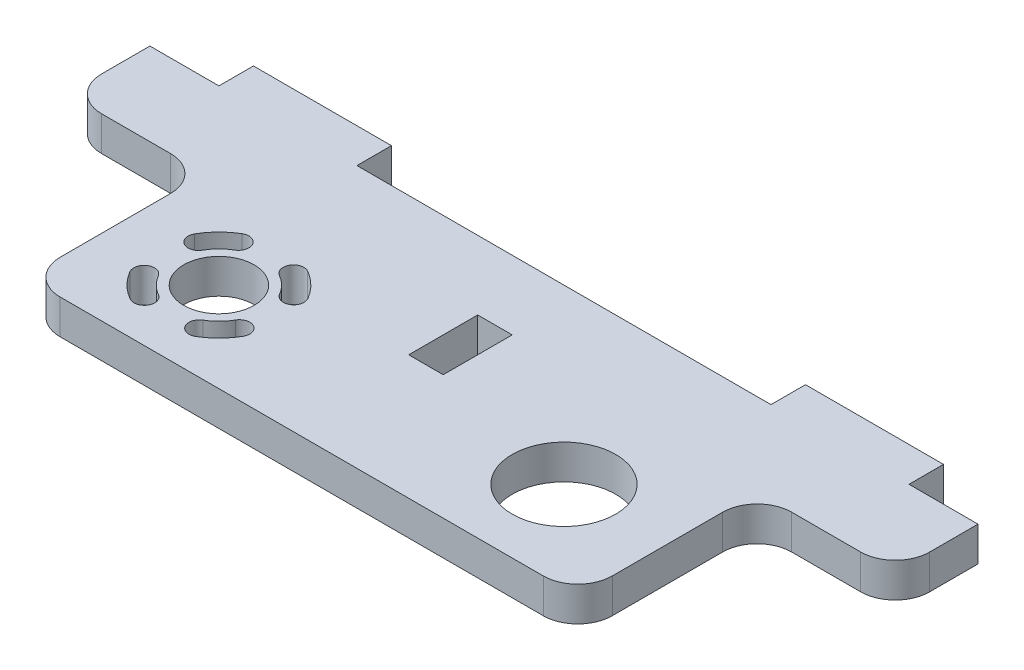
from build123d import *

# Parameters (mm, degrees)
SKETCH_1_R      = 5.1
SKETCH_1_R_2    = 7.5
SKETCH_1_W      = 5
SKETCH_1_H      = 10
EXTRUDE_1_DEPTH = 5


with BuildPart() as part:
    # 草图1 → 凸台-拉伸1 (new body)
    with BuildSketch(Plane(origin=(0, 0, 0), x_dir=(1, 0, 0), z_dir=(0, 1, 0))):
        with BuildLine():
            Line((5, 0), (75, 0))
            ThreePointArc((75, 0), (78.535533906, 1.464466094), (80, 5))
            Line((80, 5), (80, 21))
            ThreePointArc((80, 21), (81.464466094, 24.535533906), (85, 26))
            Line((85, 26), (95, 26))
            ThreePointArc((95, 26), (98.535533906, 27.464466094), (100, 31))
            Line((100, 31), (100, 38))
            Line((100, 38), (90, 38))
            Line((90, 38), (90, 43))
            Line((90, 43), (70, 43))
            Line((70, 43), (70, 38))
            Line((70, 38), (10, 38))
            Line((10, 38), (10, 43))
            Line((10, 43), (-10, 43))
            Line((-10, 43), (-10, 38))
            Line((-10, 38), (-20, 38))
            Line((-20, 38), (-20, 31))
            ThreePointArc((-20, 31), (-18.535533906, 27.464466094), (-15, 26))
            Line((-15, 26), (-5, 26))
            ThreePointArc((-5, 26), (-1.464466094, 24.535533906), (0, 21))
            Line((0, 21), (0, 5))
            ThreePointArc((0, 5), (1.464466094, 1.464466094), (5, 0))
        make_face()
        with Locations(Location((15, 13, 0), (0, 0, 270))):
            Circle(SKETCH_1_R, mode=Mode.SUBTRACT)
        with Locations(Location((65, 13, 0), (0, 0, 270))):
            Circle(SKETCH_1_R_2, mode=Mode.SUBTRACT)
        with Locations((40, 23)):
            Rectangle(SKETCH_1_W, SKETCH_1_H, mode=Mode.SUBTRACT)
        with BuildLine():
            ThreePointArc((10.242718447, 21.134042717), (8.299573716, 19.625606863), (6.813051963, 17.665646852))
            ThreePointArc((6.813051963, 17.665646852), (7.373585621, 15.619723584), (9.419508889, 16.180257242))
            ThreePointArc((9.419508889, 16.180257242), (10.432770655, 17.516229984), (11.757281553, 18.544429117))
            ThreePointArc((11.757281553, 18.544429117), (12.2948068, 20.59651747), (10.242718447, 21.134042717))
        make_face(mode=Mode.SUBTRACT)
        with BuildLine():
            ThreePointArc((23.134042717, 17.757281553), (21.625606863, 19.700426284), (19.665646852, 21.186948037))
            ThreePointArc((19.665646852, 21.186948037), (17.619723584, 20.626414379), (18.180257242, 18.580491111))
            ThreePointArc((18.180257242, 18.580491111), (19.516229984, 17.567229345), (20.544429117, 16.242718447))
            ThreePointArc((20.544429117, 16.242718447), (22.59651747, 15.7051932), (23.134042717, 17.757281553))
        make_face(mode=Mode.SUBTRACT)
        with BuildLine():
            ThreePointArc((19.757281553, 4.865957283), (21.700426284, 6.374393137), (23.186948037, 8.334353148))
            ThreePointArc((23.186948037, 8.334353148), (22.626414379, 10.380276416), (20.580491111, 9.819742758))
            ThreePointArc((20.580491111, 9.819742758), (19.567229345, 8.483770016), (18.242718447, 7.455570883))
            ThreePointArc((18.242718447, 7.455570883), (17.7051932, 5.40348253), (19.757281553, 4.865957283))
        make_face(mode=Mode.SUBTRACT)
        with BuildLine():
            ThreePointArc((6.865957283, 8.242718447), (8.374393137, 6.299573716), (10.334353148, 4.813051963))
            ThreePointArc((10.334353148, 4.813051963), (12.380276416, 5.373585621), (11.819742758, 7.419508889))
            ThreePointArc((11.819742758, 7.419508889), (10.483770016, 8.432770655), (9.455570883, 9.757281553))
            ThreePointArc((9.455570883, 9.757281553), (7.40348253, 10.2948068), (6.865957283, 8.242718447))
        make_face(mode=Mode.SUBTRACT)
    extrude(amount=EXTRUDE_1_DEPTH)


solid = part.part
